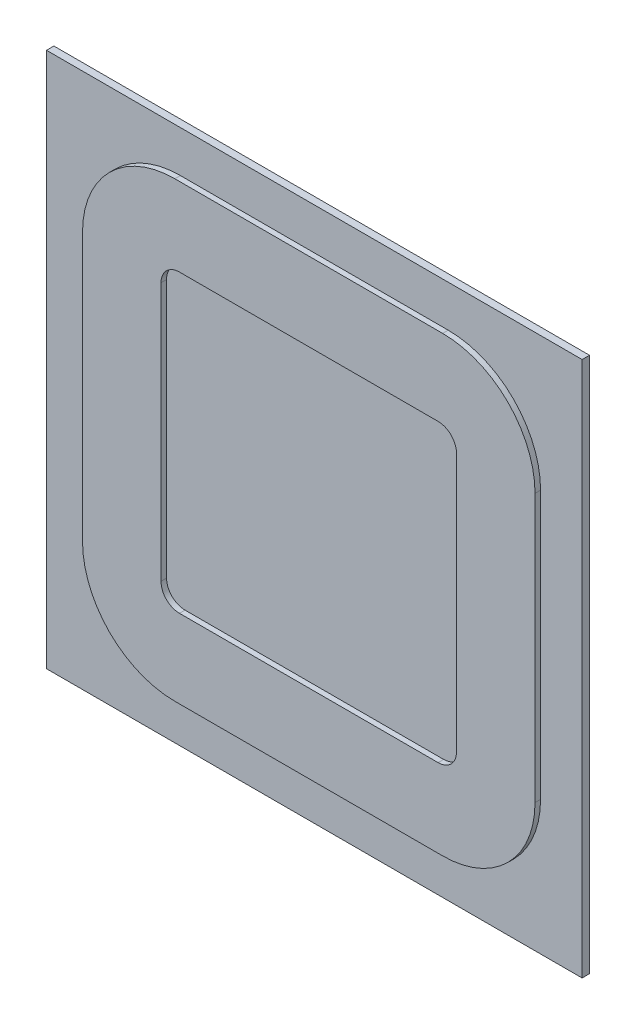
from build123d import *

# Parameters (mm, degrees)
SKETCH1_W           = 29
SKETCH1_H           = 29
BOSS_EXTRUDE1_DEPTH = 0.4
SKETCH2_W           = 24.5
SKETCH2_H           = 24.5
SKETCH2_W_2         = 16
SKETCH2_H_2         = 16
BOSS_EXTRUDE2_DEPTH = 0.3
FILLET1_R           = 5
FILLET2_R           = 1


with BuildPart() as part:
    # Sketch1 → Boss-Extrude1 (new body)
    with BuildSketch(Plane.XY):
        with Locations((14.5, 14.5)):
            Rectangle(SKETCH1_W, SKETCH1_H)
    extrude(amount=BOSS_EXTRUDE1_DEPTH)

    # Sketch2 → Boss-Extrude2 (add)
    with BuildSketch(Plane.XY.offset(0.4)):
        with Locations((14.5, 14.5)):
            Rectangle(SKETCH2_W, SKETCH2_H)
        with Locations((14.5, 14.5)):
            Rectangle(SKETCH2_W_2, SKETCH2_H_2, mode=Mode.SUBTRACT)
    extrude(amount=BOSS_EXTRUDE2_DEPTH)

    # Fillet1
    fillet1_edges = [part.edges().sort_by_distance(p)[0] for p in [
        (2.25, 26.75, 0.55),
        (2.25, 2.25, 0.55),
        (26.75, 2.25, 0.55),
        (26.75, 26.75, 0.55),
    ]]
    fillet(fillet1_edges, radius=FILLET1_R)

    # Fillet2
    fillet2_edges = [part.edges().sort_by_distance(p)[0] for p in [
        (6.5, 6.5, 0.55),
        (22.5, 6.5, 0.55),
        (22.5, 22.5, 0.55),
        (6.5, 22.5, 0.55),
    ]]
    fillet(fillet2_edges, radius=FILLET2_R)


solid = part.part
